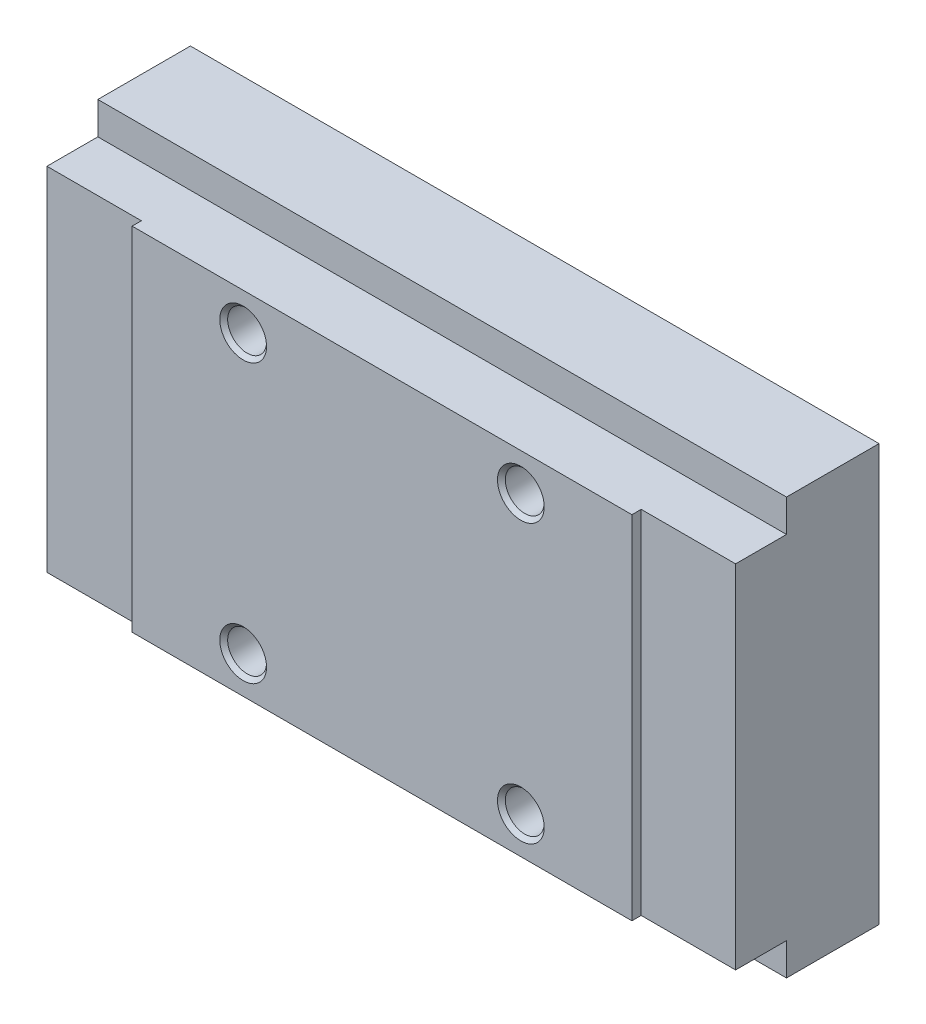
from build123d import *

# Parameters (mm, degrees)
SKETCH_1_W                   = 74.4
SKETCH_1_H                   = 45
EXTRUDE_1_DEPTH              = 10
SKETCH_2_W                   = 74.4
SKETCH_2_H                   = 38
EXTRUDE_2_DEPTH              = 6.5
HOLE_WIZARD_M5_1_D           = 4.2
HOLE_WIZARD_M5_1_DEPTH       = 12.4
HOLE_WIZARD_M5_1_CSINK_D     = 5.05
HOLE_WIZARD_M5_1_CSINK_ANGLE = 90
HOLE_WIZARD_M5_1_TIP         = 1.2618073
SKETCH_5_OUTSIDE_W           = 94.1
SKETCH_5_OUTSIDE_H           = 64.7
SKETCH_5_OUTSIDE_W_2         = 54
SKETCH_5_OUTSIDE_H_2         = 38
CUT_EXTRUDE_1_DEPTH          = 1


with BuildPart() as part:
    # 草图1 → 凸台-拉伸1 (new body)
    with BuildSketch(Plane.XY):
        with Locations((37.2, -22.5)):
            Rectangle(SKETCH_1_W, SKETCH_1_H)
    extrude(amount=EXTRUDE_1_DEPTH)

    # 草图2 → 凸台-拉伸2 (add)
    with BuildSketch(Plane.XY.offset(10)):
        with Locations((37.2, -22.5)):
            Rectangle(SKETCH_2_W, SKETCH_2_H)
    extrude(amount=EXTRUDE_2_DEPTH)

    # M5 螺纹孔1
    with Locations(Plane.XY.offset(16.5)):
        with Locations((22.2, -7.5), (52.2, -7.5), (52.2, -37.5), (22.2, -37.5)):
            CounterSinkHole(HOLE_WIZARD_M5_1_D / 2, HOLE_WIZARD_M5_1_CSINK_D / 2, depth=HOLE_WIZARD_M5_1_DEPTH, counter_sink_angle=HOLE_WIZARD_M5_1_CSINK_ANGLE)
            with Locations((0, 0, -(HOLE_WIZARD_M5_1_DEPTH + HOLE_WIZARD_M5_1_TIP / 2))):  # 118° drill point
                Cone(0, HOLE_WIZARD_M5_1_D / 2, HOLE_WIZARD_M5_1_TIP, mode=Mode.SUBTRACT)

    # 草图5 outside → 切除-拉伸1 (cut)
    with BuildSketch(Plane.XY.offset(16.5)):
        with Locations((37.2, -22.5)):
            Rectangle(SKETCH_5_OUTSIDE_W, SKETCH_5_OUTSIDE_H)
        with Locations((37.2, -22.5)):
            Rectangle(SKETCH_5_OUTSIDE_W_2, SKETCH_5_OUTSIDE_H_2, mode=Mode.SUBTRACT)
    extrude(amount=-CUT_EXTRUDE_1_DEPTH, mode=Mode.SUBTRACT)


solid = part.part
